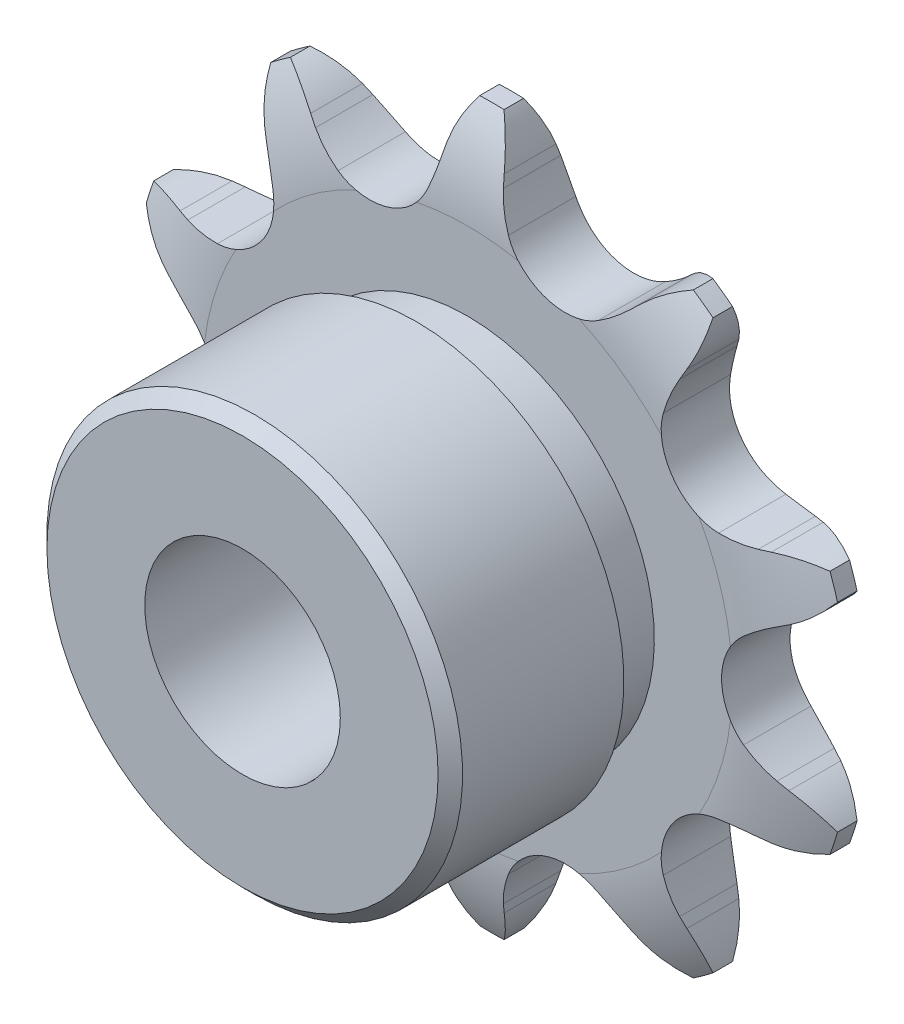
from build123d import *

# Parameters (mm, degrees)
CUT_EXTRUDE1_DEPTH      = 21.85117259
CIRPATTERN1_COUNT       = 10
BOSS_EXTRUDE1_START     = 1.4
SKETCH2_R               = 8.5
BOSS_EXTRUDE1_DEPTH     = 9.2
CUT_EXTRUDE2_DEPTH      = 23.991346491
CUT_EXTRUDE2_DEPTH_BACK = 23.991346491
SKETCH3_R               = 4
SKETCH4_W               = 2.1
SKETCH4_H               = 7.066462239


with BuildPart() as part:
    # Sketch1 → Revolve1 (revolve)
    with BuildSketch(Plane(origin=(0, 0, 0), x_dir=(0, 0, -1), z_dir=(1, 0, 0))):
        with BuildLine():
            Line((1.4, 0), (-1.4, 0))
            Line((-1.4, 0), (-1.4, 10.837750802))
            ThreePointArc((-1.4, 10.837750802), (-1.145966692, 12.837750802), (-0.4, 14.710734149))
            Line((-0.4, 14.710734149), (0.4, 14.710734149))
            ThreePointArc((0.4, 14.710734149), (1.145966692, 12.837750802), (1.4, 10.837750802))
            Line((1.4, 10.837750802), (1.4, 0))
        make_face()
    revolve(axis=Axis((0, 0, -1.4), (0, 0, 1)))

    # Sketch0 → Cut-Extrude1 (cut, symmetric)
    with BuildSketch(Plane.XY):
        with BuildLine():
            Line((6.752178894, -11.274470195), (6.440683149, -10.979903312))
            ThreePointArc((6.440683149, -10.979903312), (5.900334662, -10.521654471), (5.313656114, -10.124443232))
            ThreePointArc((5.313656114, -10.124443232), (3.211821254, -9.884969398), (1.652160321, -11.314135332))
            ThreePointArc((1.652160321, -11.314135332), (1.411002313, -11.980326974), (1.243203116, -12.668666945))
            Line((1.243203116, -12.668666945), (1.164339834, -13.090069165))
            ThreePointArc((1.164339834, -13.090069165), (-0.701731337, -15.869814152), (-4.003070971, -16.426914167))
            ThreePointArc((-4.003070971, -16.426914167), (5.22474623, -16.080115457), (12.894050334, -10.936706646))
            ThreePointArc((12.894050334, -10.936706646), (9.895755292, -12.426482016), (6.752178894, -11.274470195))
        make_face()
    cut_extrude1 = extrude(amount=CUT_EXTRUDE1_DEPTH, both=True, mode=Mode.SUBTRACT)

    # CirPattern1: Cut-Extrude1 ×10 about axis
    cirpattern1_axis = Axis((0, 0, 0), (0, 0, 1))
    for i in range(1, CIRPATTERN1_COUNT):
        add(cut_extrude1.rotate(cirpattern1_axis, i * 360 / CIRPATTERN1_COUNT), mode=Mode.SUBTRACT)

    # Sketch2 → Boss-Extrude1 (add)
    with BuildSketch(Plane.XY.offset(BOSS_EXTRUDE1_START)):
        with Locations(Location((0, 0, 0), (0, 0, 270))):
            Circle(SKETCH2_R)
    extrude(amount=BOSS_EXTRUDE1_DEPTH)

    # Sketch3 → Cut-Extrude2 (cut, two sides: drawn at the far end of the back side and taken through both)
    with BuildSketch(Plane.XY.offset(-CUT_EXTRUDE2_DEPTH_BACK)):
        Circle(SKETCH3_R)
    extrude(amount=CUT_EXTRUDE2_DEPTH + CUT_EXTRUDE2_DEPTH_BACK, mode=Mode.SUBTRACT)

    # Sketch4 → Cut-Revolve1 (revolve, cut)
    with BuildSketch(Plane(origin=(0, 0, 0), x_dir=(0, 0, -1), z_dir=(1, 0, 0))):
        Polygon((-10.6, 8.5), (-10.6, 8), (-10.1, 8.5), align=None)
        with Locations((-2.45, 11.17750303)):
            Rectangle(SKETCH4_W, SKETCH4_H)
    revolve(axis=Axis((0, 0, -1.4), (0, 0, 1)), mode=Mode.SUBTRACT)


solid = part.part
